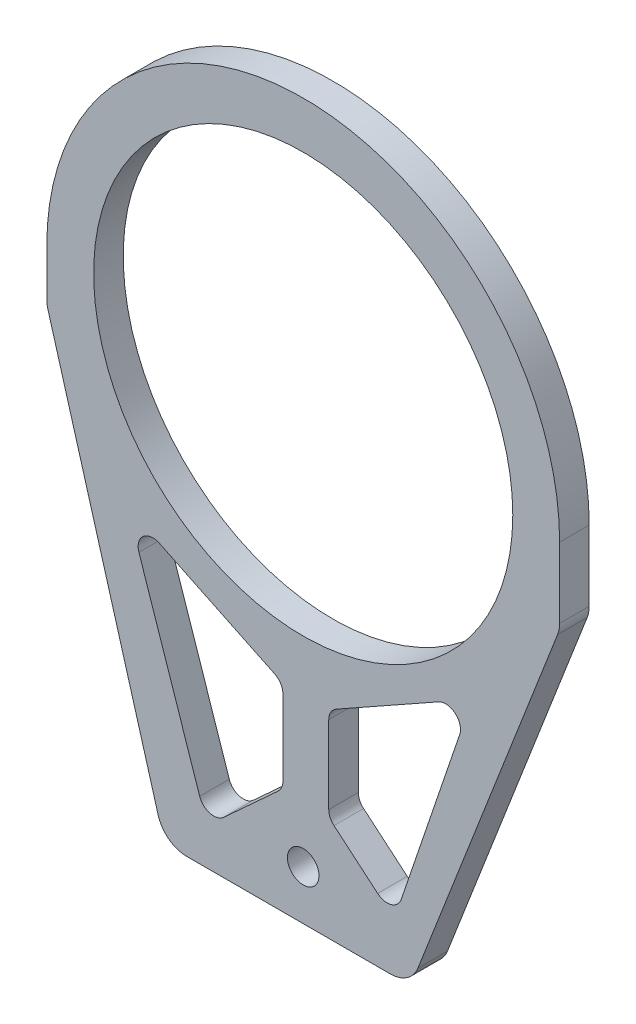
from build123d import *

# Parameters (mm, degrees)
SKETCH_1_R          = 21.25
EXTRUDE_1_DEPTH     = 3
SKETCH_2_R          = 1.6
CUT_EXTRUDE_1_DEPTH = 3
CUT_EXTRUDE_2_DEPTH = 54.359628934
FILLET_1_R          = 1.5
FILLET_2_R          = 3


with BuildPart() as part:
    # 草图1 → 凸台-拉伸1 (new body)
    with BuildSketch(Plane.XY):
        with BuildLine():
            Line((-26, 0), (-26, -46.5))
            Line((-26, -46.5), (26, -46.5))
            Line((26, -46.5), (26, 0))
            ThreePointArc((26, 0), (0, 26), (-26, 0))
        make_face()
        Circle(SKETCH_1_R, mode=Mode.SUBTRACT)
    extrude(amount=EXTRUDE_1_DEPTH)

    # 草图2 → 切除-拉伸1 (cut)
    with BuildSketch(Plane.XY.offset(3)):
        with Locations((0, -41.5)):
            Circle(SKETCH_2_R)
    extrude(amount=-CUT_EXTRUDE_1_DEPTH, mode=Mode.SUBTRACT)

    # 草图3 → 切除-拉伸2 (cut, through all)
    with BuildSketch(Plane.XY.offset(3)):
        Polygon((-26, -5.104538701), (-14.075326392, -46.5), (-26, -46.5), align=None)
        Polygon((26, -7.693867613), (10.888460039, -46.5), (26, -46.5), align=None)
        Polygon((-17.793337137, -18.847899848), (-2.05818452, -26.416707436), (-2.05818452, -35.688880127), (-9.759778205, -42.749397494), align=None)
        Polygon((17.129406646, -18.250362407), (2.589328912, -26.416707436), (2.589328912, -35.877249364), (9.228633813, -41.487929562), align=None)
    extrude(amount=-CUT_EXTRUDE_2_DEPTH, mode=Mode.SUBTRACT)

    # 圆角1
    fillet_1_edges = [part.edges().sort_by_distance(p)[0] for p in [
        (-9.759778205, -42.749397494, 1.5),
        (-17.793337137, -18.847899848, 1.5),
        (-2.05818452, -26.416707436, 1.5),
        (-2.05818452, -35.688880127, 1.5),
        (17.129406646, -18.250362407, 1.5),
        (9.228633813, -41.487929562, 1.5),
        (2.589328912, -35.877249364, 1.5),
        (2.589328912, -26.416707436, 1.5),
    ]]
    fillet(fillet_1_edges, radius=FILLET_1_R)

    # 圆角2
    fillet_2_edges = [part.edges().sort_by_distance(p)[0] for p in [
        (26, -7.693867613, 1.5),
        (10.888460039, -46.5, 1.5),
        (-26, -5.104538701, 1.5),
        (-14.075326392, -46.5, 1.5),
    ]]
    fillet(fillet_2_edges, radius=FILLET_2_R)


solid = part.part
